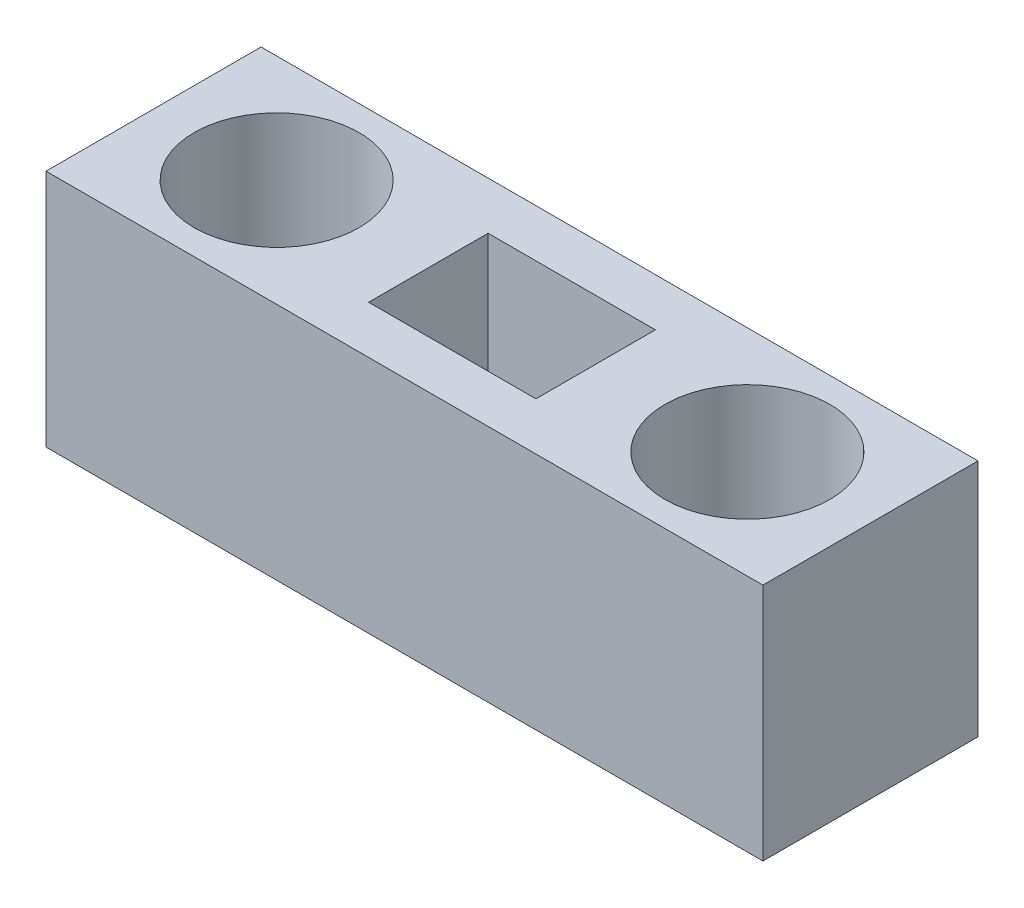
from build123d import *

# Parameters (mm, degrees)
SKETCH1_W           = 30
SKETCH1_H           = 9
SKETCH1_R           = 3.45
SKETCH1_W_2         = 7
SKETCH1_H_2         = 5
BOSS_EXTRUDE1_DEPTH = 10


with BuildPart() as part:
    # Sketch1 → Boss-Extrude1 (new body)
    with BuildSketch(Plane(origin=(0, 0, 0), x_dir=(1, 0, 0), z_dir=(0, 1, 0))):
        Rectangle(SKETCH1_W, SKETCH1_H)
        with Locations(Location((-9.85, 0, 0), (0, 0, 270))):
            Circle(SKETCH1_R, mode=Mode.SUBTRACT)
        with Locations(Location((9.85, 0, 0), (0, 0, 270))):
            Circle(SKETCH1_R, mode=Mode.SUBTRACT)
        Rectangle(SKETCH1_W_2, SKETCH1_H_2, mode=Mode.SUBTRACT)
    extrude(amount=BOSS_EXTRUDE1_DEPTH)


solid = part.part
